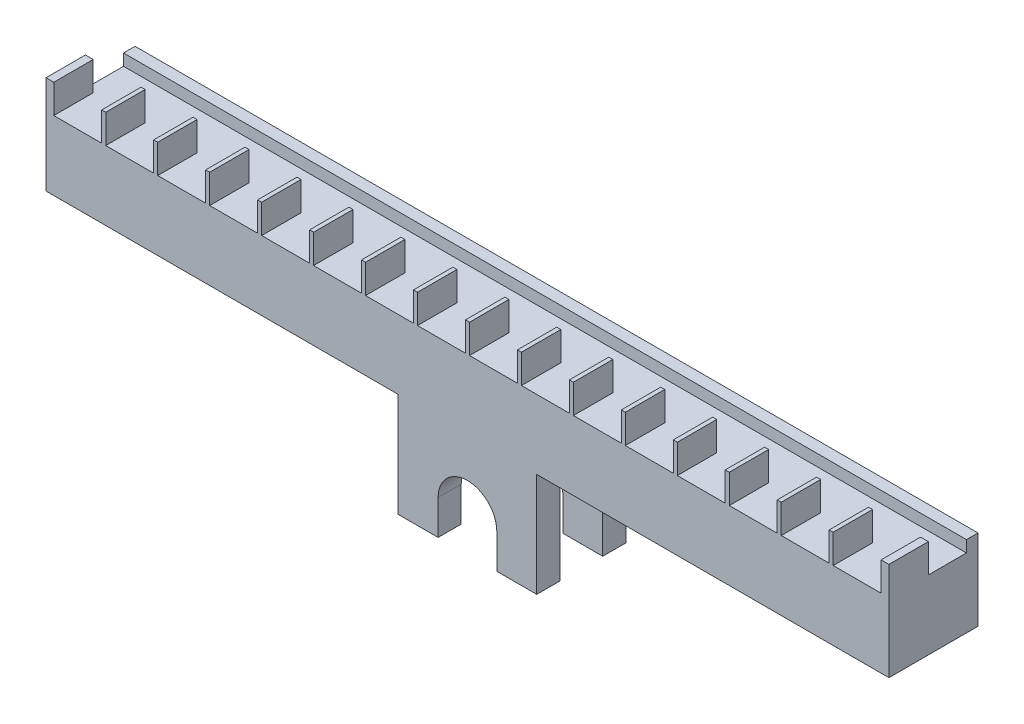
from build123d import *

# Parameters (mm, degrees)
SKETCH1_W                       = 73
SKETCH1_H                       = 7.715
BOSS_EXTRUDE1_DEPTH             = 6
SKETCH2_W                       = 73
SKETCH2_H                       = 1
BOSS_EXTRUDE2_DEPTH             = 1
SKETCH3_W                       = 0.35
SKETCH3_H                       = 7.715
BOSS_EXTRUDE3_DEPTH             = 2.5
BOSS_EXTRUDE4_REACH             = 40.165
SKETCH4_W                       = 0.325
SKETCH4_H                       = 2.5
BOSS_EXTRUDE4_DIRECTION_2_REACH = 40.165
BOSS_EXTRUDE5_REACH             = 40.165
BOSS_EXTRUDE5_DIRECTION_2_REACH = 40.165
SKETCH6_W                       = 12
SKETCH6_H                       = 3.715
CUT_EXTRUDE1_DEPTH              = 9
CUT_EXTRUDE2_DEPTH              = 39.279318502
CUT_EXTRUDE2_DEPTH_BACK         = 39.279318502


with BuildPart() as part:
    # Sketch1 → Boss-Extrude1 (new body)
    with BuildSketch(Plane(origin=(0, 0, 0), x_dir=(1, 0, 0), z_dir=(0, 1, 0))):
        with Locations((0, -3.3575)):
            Rectangle(SKETCH1_W, SKETCH1_H)
    extrude(amount=BOSS_EXTRUDE1_DEPTH)

    # Sketch2 → Boss-Extrude2 (add)
    with BuildSketch(Plane(origin=(0, 6, 0), x_dir=(1, 0, 0), z_dir=(0, 1, 0))):
        Rectangle(SKETCH2_W, SKETCH2_H)
    extrude(amount=BOSS_EXTRUDE2_DEPTH)

    # Sketch3 → Boss-Extrude3 (add)
    with BuildSketch(Plane(origin=(0, 6, 0), x_dir=(1, 0, 0), z_dir=(0, 1, 0))):
        with Locations((4.5, -3.3575)):
            Rectangle(SKETCH3_W, SKETCH3_H)
        with Locations((0, -3.3575)):
            Rectangle(SKETCH3_W, SKETCH3_H)
        with Locations((9, -3.3575)):
            Rectangle(SKETCH3_W, SKETCH3_H)
        with Locations((13.5, -3.3575)):
            Rectangle(SKETCH3_W, SKETCH3_H)
        with Locations((18, -3.3575)):
            Rectangle(SKETCH3_W, SKETCH3_H)
        with Locations((22.5, -3.3575)):
            Rectangle(SKETCH3_W, SKETCH3_H)
        with Locations((27, -3.3575)):
            Rectangle(SKETCH3_W, SKETCH3_H)
        with Locations((31.5, -3.3575)):
            Rectangle(SKETCH3_W, SKETCH3_H)
        with Locations((36, -3.3575)):
            Rectangle(SKETCH3_W, SKETCH3_H)
        with Locations((-4.5, -3.3575)):
            Rectangle(SKETCH3_W, SKETCH3_H)
        with Locations((-9, -3.3575)):
            Rectangle(SKETCH3_W, SKETCH3_H)
        with Locations((-13.5, -3.3575)):
            Rectangle(SKETCH3_W, SKETCH3_H)
        with Locations((-18, -3.3575)):
            Rectangle(SKETCH3_W, SKETCH3_H)
        with Locations((-22.5, -3.3575)):
            Rectangle(SKETCH3_W, SKETCH3_H)
        with Locations((-27, -3.3575)):
            Rectangle(SKETCH3_W, SKETCH3_H)
        with Locations((-31.5, -3.3575)):
            Rectangle(SKETCH3_W, SKETCH3_H)
        with Locations((-36, -3.3575)):
            Rectangle(SKETCH3_W, SKETCH3_H)
    extrude(amount=BOSS_EXTRUDE3_DEPTH)

    # Boss-Extrude4: up to this face of the body (flat: up to its plane)
    boss_extrude4_end = Plane(part.part.faces().sort_by_distance((0, 3.139594259, 7.215))[0])
    # Sketch4 → Boss-Extrude4 (add, up to the picked face)
    with BuildSketch(Plane.XY, mode=Mode.PRIVATE) as boss_extrude4_sk1:
        with Locations((36.3375, 7.25)):
            Rectangle(SKETCH4_W, SKETCH4_H)
    boss_extrude4_tool1 = split(extrude(boss_extrude4_sk1.sketch, amount=BOSS_EXTRUDE4_REACH, mode=Mode.PRIVATE), bisect_by=boss_extrude4_end, keep=Keep.BOTH, mode=Mode.PRIVATE)
    # Sketch4 → Boss-Extrude4 (add, up to the picked face)
    with BuildSketch(Plane.XY, mode=Mode.PRIVATE) as boss_extrude4_sk2:
        with Locations((-36.3375, 7.25)):
            Rectangle(SKETCH4_W, SKETCH4_H)
    boss_extrude4_tool2 = split(extrude(boss_extrude4_sk2.sketch, amount=BOSS_EXTRUDE4_REACH, mode=Mode.PRIVATE), bisect_by=boss_extrude4_end, keep=Keep.BOTH, mode=Mode.PRIVATE)
    add(boss_extrude4_tool1.solids().sort_by(Axis((36.3375, 7.25, 0), (0, 0, 1)))[0])
    add(boss_extrude4_tool2.solids().sort_by(Axis((-36.3375, 7.25, 0), (0, 0, 1)))[0])

    # Boss-Extrude4 direction 2: up to this face of the body (flat: up to its plane)
    boss_extrude4_direction_2_end = Plane(part.part.faces().sort_by_distance((0, 3.572955234, -0.5))[0])
    # Sketch4 → Boss-Extrude4 direction 2 (add, up to the picked face)
    with BuildSketch(Plane.XY, mode=Mode.PRIVATE) as boss_extrude4_direction_2_sk1:
        with Locations((36.3375, 7.25)):
            Rectangle(SKETCH4_W, SKETCH4_H)
    boss_extrude4_direction_2_tool1 = split(extrude(boss_extrude4_direction_2_sk1.sketch, amount=-BOSS_EXTRUDE4_DIRECTION_2_REACH, mode=Mode.PRIVATE), bisect_by=boss_extrude4_direction_2_end, keep=Keep.BOTH, mode=Mode.PRIVATE)
    # Sketch4 → Boss-Extrude4 direction 2 (add, up to the picked face)
    with BuildSketch(Plane.XY, mode=Mode.PRIVATE) as boss_extrude4_direction_2_sk2:
        with Locations((-36.3375, 7.25)):
            Rectangle(SKETCH4_W, SKETCH4_H)
    boss_extrude4_direction_2_tool2 = split(extrude(boss_extrude4_direction_2_sk2.sketch, amount=-BOSS_EXTRUDE4_DIRECTION_2_REACH, mode=Mode.PRIVATE), bisect_by=boss_extrude4_direction_2_end, keep=Keep.BOTH, mode=Mode.PRIVATE)
    add(boss_extrude4_direction_2_tool1.solids().sort_by(Axis((36.3375, 7.25, 0), (0, 0, -1)))[0])
    add(boss_extrude4_direction_2_tool2.solids().sort_by(Axis((-36.3375, 7.25, 0), (0, 0, -1)))[0])

    # Boss-Extrude5: up to this face of the body (flat: up to its plane)
    boss_extrude5_end = Plane(part.part.faces().sort_by_distance((0, 3.154290429, 7.215))[0])
    # Sketch5 → Boss-Extrude5 (add, up to the picked face)
    with BuildSketch(Plane.XY, mode=Mode.PRIVATE) as boss_extrude5_sk1:
        with BuildLine():
            Line((-2.54, -6), (-2.54, -9))
            Line((-2.54, -9), (-6, -9))
            Line((-6, -9), (-6, 0))
            Line((-6, 0), (6, 0))
            Line((6, 0), (6, -9))
            Line((6, -9), (2.54, -9))
            Line((2.54, -9), (2.54, -6))
            ThreePointArc((2.54, -6), (0, -3.46), (-2.54, -6))
        make_face()
    boss_extrude5_tool1 = split(extrude(boss_extrude5_sk1.sketch, amount=BOSS_EXTRUDE5_REACH, mode=Mode.PRIVATE), bisect_by=boss_extrude5_end, keep=Keep.BOTH, mode=Mode.PRIVATE)
    add(boss_extrude5_tool1.solids().sort_by(Axis((-2.69, -7.5, 0), (0, 0, 1)))[0])

    # Boss-Extrude5 direction 2: up to this face of the body (flat: up to its plane)
    boss_extrude5_direction_2_end = Plane(part.part.faces().sort_by_distance((0, 3.580773661, -0.5))[0])
    # Sketch5 → Boss-Extrude5 direction 2 (add, up to the picked face)
    with BuildSketch(Plane.XY, mode=Mode.PRIVATE) as boss_extrude5_direction_2_sk1:
        with BuildLine():
            Line((-2.54, -6), (-2.54, -9))
            Line((-2.54, -9), (-6, -9))
            Line((-6, -9), (-6, 0))
            Line((-6, 0), (6, 0))
            Line((6, 0), (6, -9))
            Line((6, -9), (2.54, -9))
            Line((2.54, -9), (2.54, -6))
            ThreePointArc((2.54, -6), (0, -3.46), (-2.54, -6))
        make_face()
    boss_extrude5_direction_2_tool1 = split(extrude(boss_extrude5_direction_2_sk1.sketch, amount=-BOSS_EXTRUDE5_DIRECTION_2_REACH, mode=Mode.PRIVATE), bisect_by=boss_extrude5_direction_2_end, keep=Keep.BOTH, mode=Mode.PRIVATE)
    add(boss_extrude5_direction_2_tool1.solids().sort_by(Axis((-2.69, -7.5, 0), (0, 0, -1)))[0])

    # Sketch6 → Cut-Extrude1 (cut)
    with BuildSketch(Plane.XZ.offset(9)):
        with Locations((0, 3.3575)):
            Rectangle(SKETCH6_W, SKETCH6_H)
    extrude(amount=-CUT_EXTRUDE1_DEPTH, mode=Mode.SUBTRACT)

    # Sketch7 → Cut-Extrude2 (cut, two sides: drawn at the far end of the back side and taken through both)
    with BuildSketch(Plane(origin=(0, 0, 0), x_dir=(0, 0, -1), z_dir=(1, 0, 0)).offset(-CUT_EXTRUDE2_DEPTH_BACK)):
        Polygon((0.5, 7), (-0.5, 7), (-0.5, 6), (-3.802, 6), (-3.802, 8.5), (0.5, 8.5), align=None)
    extrude(amount=CUT_EXTRUDE2_DEPTH + CUT_EXTRUDE2_DEPTH_BACK, mode=Mode.SUBTRACT)


solid = part.part
